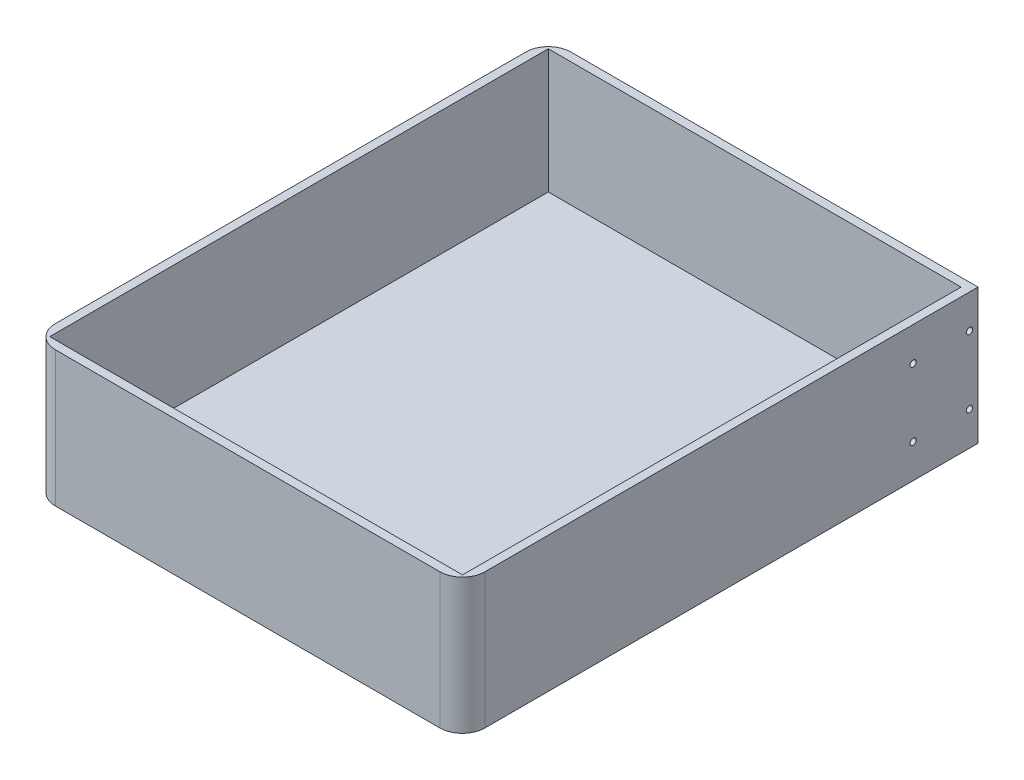
from build123d import *

# Parameters (mm, degrees)
SKETCH1_W           = 381
SKETCH1_H           = 457.2
SKETCH1_W_2         = 366
SKETCH1_H_2         = 442.1
BOSS_EXTRUDE1_DEPTH = 120
SKETCH2_W           = 366
SKETCH2_H           = 442.1
BOSS_EXTRUDE2_DEPTH = 10
FILLET1_R           = 20
CUT_EXTRUDE1_DEPTH  = 10


with BuildPart() as part:
    # Sketch1 → Boss-Extrude1 (new body)
    with BuildSketch(Plane(origin=(0, 0, 0), x_dir=(1, 0, 0), z_dir=(0, 1, 0))):
        with Locations((190.5, 228.6)):
            Rectangle(SKETCH1_W, SKETCH1_H)
        with Locations((190.5, 228.65)):
            Rectangle(SKETCH1_W_2, SKETCH1_H_2, mode=Mode.SUBTRACT)
    extrude(amount=BOSS_EXTRUDE1_DEPTH)

    # Sketch2 → Boss-Extrude2 (add)
    with BuildSketch(Plane.XZ):
        with Locations((190.5, -228.65)):
            Rectangle(SKETCH2_W, SKETCH2_H)
    extrude(amount=-BOSS_EXTRUDE2_DEPTH)

    # Fillet1
    fillet1_edges = [part.edges().sort_by_distance(p)[0] for p in [
        (0, 60, -457.2),
        (381, 60, 0),
        (0, 60, 0),
    ]]
    fillet(fillet1_edges, radius=FILLET1_R)

    # Sketch3 → Cut-Extrude1 (cut)
    with BuildSketch(Plane(origin=(381, 0, 0), x_dir=(0, 0, -1), z_dir=(1, 0, 0))):
        with BuildLine():
            Line((399.7, 87.25), (399.7, 90))
            Line((399.7, 90), (402.45, 90))
            ThreePointArc((402.45, 90), (397.755456352, 91.944543648), (399.7, 87.25))
        make_face()
        with BuildLine():
            Line((402.45, 90), (399.7, 90))
            Line((399.7, 90), (399.7, 87.25))
            ThreePointArc((399.7, 87.25), (401.644543648, 88.055456352), (402.45, 90))
        make_face()
        with BuildLine():
            ThreePointArc((452.45, 90), (449.7, 92.75), (446.95, 90))
            Line((446.95, 90), (449.7, 90))
            Line((449.7, 90), (449.7, 87.25))
            ThreePointArc((449.7, 87.25), (451.644543648, 88.055456352), (452.45, 90))
        make_face()
        with BuildLine():
            Line((449.7, 90), (446.95, 90))
            ThreePointArc((446.95, 90), (447.755456352, 88.055456352), (449.7, 87.25))
            Line((449.7, 87.25), (449.7, 90))
        make_face()
        with BuildLine():
            ThreePointArc((452.45, 30), (451.644543648, 31.944543648), (449.7, 32.75))
            Line((449.7, 32.75), (449.7, 30))
            Line((449.7, 30), (446.95, 30))
            ThreePointArc((446.95, 30), (449.7, 27.25), (452.45, 30))
        make_face()
        with BuildLine():
            Line((449.7, 30), (449.7, 32.75))
            ThreePointArc((449.7, 32.75), (447.755456352, 31.944543648), (446.95, 30))
            Line((446.95, 30), (449.7, 30))
        make_face()
        with BuildLine():
            ThreePointArc((402.45, 30), (401.644543648, 31.944543648), (399.7, 32.75))
            Line((399.7, 32.75), (399.7, 30))
            Line((399.7, 30), (402.45, 30))
        make_face()
        with BuildLine():
            Line((399.7, 30), (399.7, 32.75))
            ThreePointArc((399.7, 32.75), (397.755456352, 28.055456352), (402.45, 30))
            Line((402.45, 30), (399.7, 30))
        make_face()
    extrude(amount=-CUT_EXTRUDE1_DEPTH, mode=Mode.SUBTRACT)


solid = part.part
